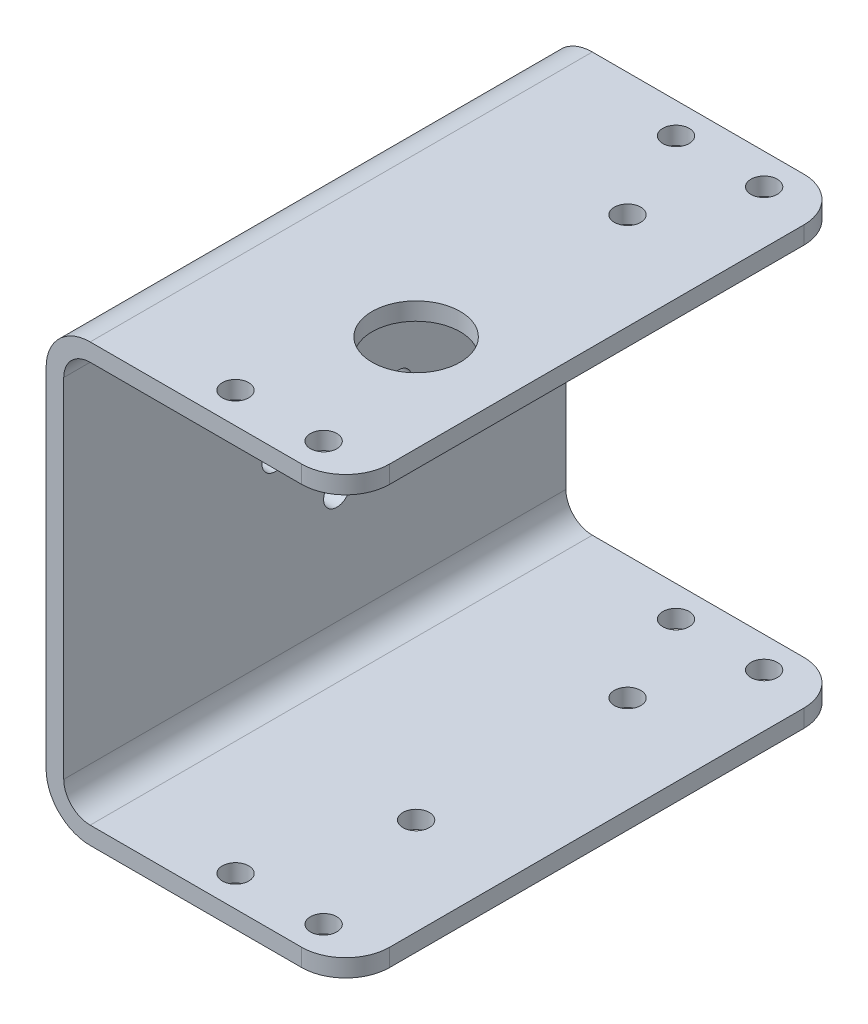
from build123d import *

# Parameters (mm, degrees)
EXTRUDE_1_DEPTH     = 57
SKETCH_2_R          = 1.5
CUT_EXTRUDE_1_DEPTH = 57
SKETCH_4_R          = 4
SKETCH_4_R_2        = 1.5
CUT_EXTRUDE_2_DEPTH = 57
FILLET_1_R          = 5
FILLET_2_R          = 3
FILLET_3_R          = 5
SKETCH_5_R          = 5
CUT_EXTRUDE_3_DEPTH = 26
SKETCH_6_R          = 1.5
CUT_EXTRUDE_4_DEPTH = 71


with BuildPart() as part:
    # 草图1 → 凸台-拉伸1 (new body)
    with BuildSketch(Plane.XY):
        Polygon((-17, -24.75), (17, -24.75), (17, -22.75), (-15, -22.75), (-15, 22.75), (17, 22.75), (17, 24.75), (-17, 24.75), align=None)
    extrude(amount=EXTRUDE_1_DEPTH)

    # 草图2 → 切除-拉伸1 (cut)
    with BuildSketch(Plane(origin=(0, 24.75, 0), x_dir=(1, 0, 0), z_dir=(0, 1, 0))):
        with Locations(Location((6, -14, 0), (0, 0, 270))):
            Circle(SKETCH_2_R)
        with Locations(Location((6, -38, 0), (0, 0, 270))):
            Circle(SKETCH_2_R)
    extrude(amount=-CUT_EXTRUDE_1_DEPTH, mode=Mode.SUBTRACT)

    # 草图4 → 切除-拉伸2 (cut)
    with BuildSketch(Plane.ZY.offset(17)):
        with Locations((26, 0)):
            Circle(SKETCH_4_R)
        with Locations((26, 7)):
            Circle(SKETCH_4_R_2)
        with Locations((33, 0)):
            Circle(SKETCH_4_R_2)
        with Locations((26, -7)):
            Circle(SKETCH_4_R_2)
        with Locations((19, 0)):
            Circle(SKETCH_4_R_2)
    extrude(amount=-CUT_EXTRUDE_2_DEPTH, mode=Mode.SUBTRACT)

    # 圆角1
    fillet_1_edges = [part.edges().sort_by_distance(p)[0] for p in [
        (-17, -24.75, 28.5),
        (-17, 24.75, 28.5),
    ]]
    fillet(fillet_1_edges, radius=FILLET_1_R)

    # 圆角2
    fillet_2_edges = [part.edges().sort_by_distance(p)[0] for p in [
        (-15, 22.75, 28.5),
        (-15, -22.75, 28.5),
    ]]
    fillet(fillet_2_edges, radius=FILLET_2_R)

    # 圆角3
    fillet_3_edges = [part.edges().sort_by_distance(p)[0] for p in [
        (17, 23.75, 0),
        (17, -23.75, 57),
        (17, 23.75, 57),
        (17, -23.75, 0),
    ]]
    fillet(fillet_3_edges, radius=FILLET_3_R)

    # 草图5 → 切除-拉伸3 (cut)
    with BuildSketch(Plane(origin=(0, 24.75, 0), x_dir=(1, 0, 0), z_dir=(0, 1, 0))):
        with Locations(Location((6, -38, 0), (0, 0, 270))):
            Circle(SKETCH_5_R)
    extrude(amount=-CUT_EXTRUDE_3_DEPTH, mode=Mode.SUBTRACT)

    # 草图6 → 切除-拉伸4 (cut)
    with BuildSketch(Plane.XZ.offset(24.75)):
        with Locations(Location((1, 53.5, 0), (0, 0, 270))):
            Circle(SKETCH_6_R)
        with Locations(Location((11, 53.5, 0), (0, 0, 270))):
            Circle(SKETCH_6_R)
        with Locations(Location((11, 3.5, 0), (0, 0, 270))):
            Circle(SKETCH_6_R)
        with Locations(Location((1, 3.5, 0), (0, 0, 270))):
            Circle(SKETCH_6_R)
    extrude(amount=-CUT_EXTRUDE_4_DEPTH, mode=Mode.SUBTRACT)


solid = part.part
